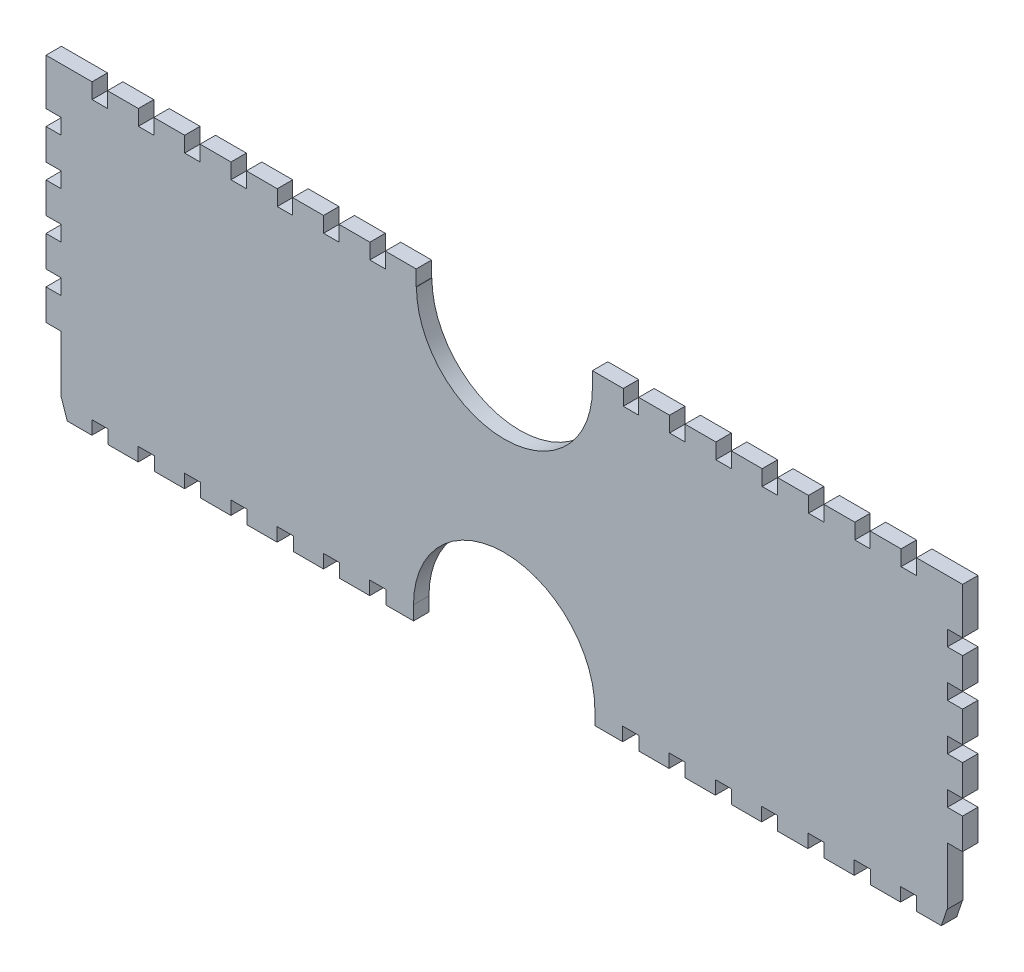
from build123d import *

# Parameters (mm, degrees)
ESQUISSE1_W                = 296.913296363
ESQUISSE1_H                = 99.202689883
BOSS_EXTRU_1_DEPTH         = 5
ENL_V_MAT_EXTRU_1_DEPTH    = 10
ESQUISSE3_W                = 5.229303798
ESQUISSE3_H                = 4.396229451
ENL_V_MAT_EXTRU_2_DEPTH    = 10
R_P_TITION_LIN_AIRE1_COUNT = 7
R_P_TITION_LIN_AIRE1_PITCH = 15
SYM_TRIE1_COPY_1_SKETCH_W  = 5.229303798
SYM_TRIE1_COPY_1_SKETCH_H  = 4.396229451
SYM_TRIE1_COPY_1_DEPTH     = 10
SYM_TRIE1_COPY_2_SKETCH_W  = 5.229303798
SYM_TRIE1_COPY_2_SKETCH_H  = 4.396229451
SYM_TRIE1_COPY_2_DEPTH     = 10
SYM_TRIE1_COPY_3_SKETCH_W  = 5.229303798
SYM_TRIE1_COPY_3_SKETCH_H  = 4.396229451
SYM_TRIE1_COPY_3_DEPTH     = 10
SYM_TRIE1_COPY_4_SKETCH_W  = 5.229303798
SYM_TRIE1_COPY_4_SKETCH_H  = 4.396229451
SYM_TRIE1_COPY_4_DEPTH     = 10
SYM_TRIE1_COPY_5_SKETCH_W  = 5.229303798
SYM_TRIE1_COPY_5_SKETCH_H  = 4.396229451
SYM_TRIE1_COPY_5_DEPTH     = 10
SYM_TRIE1_COPY_6_SKETCH_W  = 5.229303798
SYM_TRIE1_COPY_6_SKETCH_H  = 4.396229451
SYM_TRIE1_COPY_6_DEPTH     = 10
ESQUISSE4_W                = 58.738288448
ESQUISSE4_H                = 4.540442772
ENL_V_MAT_EXTRU_3_DEPTH    = 10
ENL_V_MAT_EXTRU_4_DEPTH    = 10
ESQUISSE6_W                = 5
ESQUISSE6_H                = 5
ENL_V_MAT_EXTRU_5_DEPTH    = 5
R_P_TITION_LIN_AIRE2_COUNT = 8
R_P_TITION_LIN_AIRE2_PITCH = 15
ESQUISSE7_W                = 57
ESQUISSE7_H                = 5
ENL_V_MAT_EXTRU_6_DEPTH    = 5
ENL_V_MAT_EXTRU_7_DEPTH    = 5
SYM_TRIE2_COPY_1_SKETCH_W  = 5
SYM_TRIE2_COPY_1_SKETCH_H  = 5
SYM_TRIE2_COPY_1_DEPTH     = 5
SYM_TRIE2_COPY_2_SKETCH_W  = 5
SYM_TRIE2_COPY_2_SKETCH_H  = 5
SYM_TRIE2_COPY_2_DEPTH     = 5
SYM_TRIE2_COPY_3_SKETCH_W  = 5
SYM_TRIE2_COPY_3_SKETCH_H  = 5
SYM_TRIE2_COPY_3_DEPTH     = 5
SYM_TRIE2_COPY_4_SKETCH_W  = 5
SYM_TRIE2_COPY_4_SKETCH_H  = 5
SYM_TRIE2_COPY_4_DEPTH     = 5
SYM_TRIE2_COPY_5_SKETCH_W  = 5
SYM_TRIE2_COPY_5_SKETCH_H  = 5
SYM_TRIE2_COPY_5_DEPTH     = 5
SYM_TRIE2_COPY_6_SKETCH_W  = 5
SYM_TRIE2_COPY_6_SKETCH_H  = 5
SYM_TRIE2_COPY_6_DEPTH     = 5
SYM_TRIE2_COPY_7_SKETCH_W  = 5
SYM_TRIE2_COPY_7_SKETCH_H  = 5
SYM_TRIE2_COPY_7_DEPTH     = 5
ESQUISSE9_W                = 4.913296363
ESQUISSE9_H                = 18.600386247
ENL_V_MAT_EXTRU_8_DEPTH    = 5
ESQUISSE10_W               = 5
ESQUISSE10_H               = 5
ENL_V_MAT_EXTRU_9_DEPTH    = 5
R_P_TITION_LIN_AIRE3_COUNT = 4
R_P_TITION_LIN_AIRE3_PITCH = 15
SYM_TRIE3_COPY_1_SKETCH_W  = 5
SYM_TRIE3_COPY_1_SKETCH_H  = 5
SYM_TRIE3_COPY_1_DEPTH     = 5
SYM_TRIE3_COPY_2_SKETCH_W  = 5
SYM_TRIE3_COPY_2_SKETCH_H  = 5
SYM_TRIE3_COPY_2_DEPTH     = 5
SYM_TRIE3_COPY_3_SKETCH_W  = 5
SYM_TRIE3_COPY_3_SKETCH_H  = 5
SYM_TRIE3_COPY_3_DEPTH     = 5


with BuildPart() as part:
    # Esquisse1 → Boss.-Extru.1 (new body)
    with BuildSketch(Plane.XY):
        with Locations((104.081072913, -34.511559996)):
            Rectangle(ESQUISSE1_W, ESQUISSE1_H)
    extrude(amount=BOSS_EXTRU_1_DEPTH)

    # Esquisse2 → Enlèv. mat.-Extru.1 (cut)
    with BuildSketch(Plane(origin=(0, 0, 0), x_dir=(-1, 0, 0), z_dir=(0, 0, -1))):
        Polygon((44.375575269, -78.510601301), (39.375575269, -78.510601301), (37.504666451, -84.112904937), (44.375575269, -84.112904937), align=None)
    enl_v_mat_extru_1 = extrude(amount=-ENL_V_MAT_EXTRU_1_DEPTH, mode=Mode.SUBTRACT)

    # Esquisse3 → Enlèv. mat.-Extru.2 (cut)
    with BuildSketch(Plane(origin=(0, 0, 0), x_dir=(-1, 0, 0), z_dir=(0, 0, -1))):
        with Locations((26.890031572, -81.914790212)):
            Rectangle(ESQUISSE3_W, ESQUISSE3_H)
    enl_v_mat_extru_2 = extrude(amount=-ENL_V_MAT_EXTRU_2_DEPTH, mode=Mode.SUBTRACT)

    # Répétition linéaire1: Enlèv. mat.-Extru.2 ×7
    with Locations(*[(i * R_P_TITION_LIN_AIRE1_PITCH, 0, 0) for i in range(1, R_P_TITION_LIN_AIRE1_COUNT)]):
        add(enl_v_mat_extru_2, mode=Mode.SUBTRACT)

    # Symétrie1: Enlèv. mat.-Extru.1, Enlèv. mat.-Extru.2 across plane
    add(enl_v_mat_extru_1.mirror(Plane.ZY.offset(-104.081072913)), mode=Mode.SUBTRACT)
    add(enl_v_mat_extru_2.mirror(Plane.ZY.offset(-104.081072913)), mode=Mode.SUBTRACT)

    # Symétrie1 copy 1 sketch → Symétrie1 copy 1 (cut)
    with BuildSketch(Plane(origin=(193.162145825, 0, 0), x_dir=(1, 0, 0), z_dir=(0, 0, -1))):
        with Locations((26.890031572, 81.914790212)):
            Rectangle(SYM_TRIE1_COPY_1_SKETCH_W, SYM_TRIE1_COPY_1_SKETCH_H)
    extrude(amount=-SYM_TRIE1_COPY_1_DEPTH, mode=Mode.SUBTRACT)

    # Symétrie1 copy 2 sketch → Symétrie1 copy 2 (cut)
    with BuildSketch(Plane(origin=(178.162145825, 0, 0), x_dir=(1, 0, 0), z_dir=(0, 0, -1))):
        with Locations((26.890031572, 81.914790212)):
            Rectangle(SYM_TRIE1_COPY_2_SKETCH_W, SYM_TRIE1_COPY_2_SKETCH_H)
    extrude(amount=-SYM_TRIE1_COPY_2_DEPTH, mode=Mode.SUBTRACT)

    # Symétrie1 copy 3 sketch → Symétrie1 copy 3 (cut)
    with BuildSketch(Plane(origin=(163.162145825, 0, 0), x_dir=(1, 0, 0), z_dir=(0, 0, -1))):
        with Locations((26.890031572, 81.914790212)):
            Rectangle(SYM_TRIE1_COPY_3_SKETCH_W, SYM_TRIE1_COPY_3_SKETCH_H)
    extrude(amount=-SYM_TRIE1_COPY_3_DEPTH, mode=Mode.SUBTRACT)

    # Symétrie1 copy 4 sketch → Symétrie1 copy 4 (cut)
    with BuildSketch(Plane(origin=(148.162145825, 0, 0), x_dir=(1, 0, 0), z_dir=(0, 0, -1))):
        with Locations((26.890031572, 81.914790212)):
            Rectangle(SYM_TRIE1_COPY_4_SKETCH_W, SYM_TRIE1_COPY_4_SKETCH_H)
    extrude(amount=-SYM_TRIE1_COPY_4_DEPTH, mode=Mode.SUBTRACT)

    # Symétrie1 copy 5 sketch → Symétrie1 copy 5 (cut)
    with BuildSketch(Plane(origin=(133.162145825, 0, 0), x_dir=(1, 0, 0), z_dir=(0, 0, -1))):
        with Locations((26.890031572, 81.914790212)):
            Rectangle(SYM_TRIE1_COPY_5_SKETCH_W, SYM_TRIE1_COPY_5_SKETCH_H)
    extrude(amount=-SYM_TRIE1_COPY_5_DEPTH, mode=Mode.SUBTRACT)

    # Symétrie1 copy 6 sketch → Symétrie1 copy 6 (cut)
    with BuildSketch(Plane(origin=(118.162145825, 0, 0), x_dir=(1, 0, 0), z_dir=(0, 0, -1))):
        with Locations((26.890031572, 81.914790212)):
            Rectangle(SYM_TRIE1_COPY_6_SKETCH_W, SYM_TRIE1_COPY_6_SKETCH_H)
    extrude(amount=-SYM_TRIE1_COPY_6_DEPTH, mode=Mode.SUBTRACT)

    # Esquisse4 → Enlèv. mat.-Extru.3 (cut)
    with BuildSketch(Plane(origin=(0, 0, 0), x_dir=(-1, 0, 0), z_dir=(0, 0, -1))):
        with Locations((-104.051236875, -81.842683551)):
            Rectangle(ESQUISSE4_W, ESQUISSE4_H)
    extrude(amount=-ENL_V_MAT_EXTRU_3_DEPTH, mode=Mode.SUBTRACT)

    # Esquisse5 → Enlèv. mat.-Extru.4 (cut)
    with BuildSketch(Plane(origin=(0, 0, 0), x_dir=(-1, 0, 0), z_dir=(0, 0, -1))):
        with BuildLine():
            Line((-74.682092651, -79.572462165), (-133.420381099, -79.572462165))
            ThreePointArc((-133.420381099, -79.572462165), (-104.051236875, -50.20331794), (-74.682092651, -79.572462165))
        make_face()
    extrude(amount=-ENL_V_MAT_EXTRU_4_DEPTH, mode=Mode.SUBTRACT)

    # Esquisse6 → Enlèv. mat.-Extru.5 (cut)
    with BuildSketch(Plane.XY.offset(5)):
        with Locations((235.124424731, 12.589784946)):
            Rectangle(ESQUISSE6_W, ESQUISSE6_H)
    enl_v_mat_extru_5 = extrude(amount=-ENL_V_MAT_EXTRU_5_DEPTH, mode=Mode.SUBTRACT)

    # Répétition linéaire2: Enlèv. mat.-Extru.5 ×8
    with Locations(*[(-i * R_P_TITION_LIN_AIRE2_PITCH, 0, 0) for i in range(1, R_P_TITION_LIN_AIRE2_COUNT)]):
        add(enl_v_mat_extru_5, mode=Mode.SUBTRACT)

    # Esquisse7 → Enlèv. mat.-Extru.6 (cut)
    with BuildSketch(Plane.XY.offset(5)):
        with Locations((104.124424731, 12.589784946)):
            Rectangle(ESQUISSE7_W, ESQUISSE7_H)
    extrude(amount=-ENL_V_MAT_EXTRU_6_DEPTH, mode=Mode.SUBTRACT)

    # Esquisse8 → Enlèv. mat.-Extru.7 (cut)
    with BuildSketch(Plane.XY.offset(5)):
        with BuildLine():
            ThreePointArc((132.624424731, 10.089784946), (104.124424731, -18.410215054), (75.624424731, 10.089784946))
            Line((75.624424731, 10.089784946), (132.624424731, 10.089784946))
        make_face()
    extrude(amount=-ENL_V_MAT_EXTRU_7_DEPTH, mode=Mode.SUBTRACT)

    # Symétrie2: Enlèv. mat.-Extru.5 across plane
    add(enl_v_mat_extru_5.mirror(Plane(origin=(104.081072913, 0, 0), x_dir=(0, 0, 1), z_dir=(1, 0, 0))), mode=Mode.SUBTRACT)

    # Symétrie2 copy 1 sketch → Symétrie2 copy 1 (cut)
    with BuildSketch(Plane(origin=(223.162145825, 0, 5), x_dir=(-1, 0, 0), z_dir=(0, 0, 1))):
        with Locations((235.124424731, -12.589784946)):
            Rectangle(SYM_TRIE2_COPY_1_SKETCH_W, SYM_TRIE2_COPY_1_SKETCH_H)
    extrude(amount=-SYM_TRIE2_COPY_1_DEPTH, mode=Mode.SUBTRACT)

    # Symétrie2 copy 2 sketch → Symétrie2 copy 2 (cut)
    with BuildSketch(Plane(origin=(238.162145825, 0, 5), x_dir=(-1, 0, 0), z_dir=(0, 0, 1))):
        with Locations((235.124424731, -12.589784946)):
            Rectangle(SYM_TRIE2_COPY_2_SKETCH_W, SYM_TRIE2_COPY_2_SKETCH_H)
    extrude(amount=-SYM_TRIE2_COPY_2_DEPTH, mode=Mode.SUBTRACT)

    # Symétrie2 copy 3 sketch → Symétrie2 copy 3 (cut)
    with BuildSketch(Plane(origin=(253.162145825, 0, 5), x_dir=(-1, 0, 0), z_dir=(0, 0, 1))):
        with Locations((235.124424731, -12.589784946)):
            Rectangle(SYM_TRIE2_COPY_3_SKETCH_W, SYM_TRIE2_COPY_3_SKETCH_H)
    extrude(amount=-SYM_TRIE2_COPY_3_DEPTH, mode=Mode.SUBTRACT)

    # Symétrie2 copy 4 sketch → Symétrie2 copy 4 (cut)
    with BuildSketch(Plane(origin=(268.162145825, 0, 5), x_dir=(-1, 0, 0), z_dir=(0, 0, 1))):
        with Locations((235.124424731, -12.589784946)):
            Rectangle(SYM_TRIE2_COPY_4_SKETCH_W, SYM_TRIE2_COPY_4_SKETCH_H)
    extrude(amount=-SYM_TRIE2_COPY_4_DEPTH, mode=Mode.SUBTRACT)

    # Symétrie2 copy 5 sketch → Symétrie2 copy 5 (cut)
    with BuildSketch(Plane(origin=(283.162145825, 0, 5), x_dir=(-1, 0, 0), z_dir=(0, 0, 1))):
        with Locations((235.124424731, -12.589784946)):
            Rectangle(SYM_TRIE2_COPY_5_SKETCH_W, SYM_TRIE2_COPY_5_SKETCH_H)
    extrude(amount=-SYM_TRIE2_COPY_5_DEPTH, mode=Mode.SUBTRACT)

    # Symétrie2 copy 6 sketch → Symétrie2 copy 6 (cut)
    with BuildSketch(Plane(origin=(298.162145825, 0, 5), x_dir=(-1, 0, 0), z_dir=(0, 0, 1))):
        with Locations((235.124424731, -12.589784946)):
            Rectangle(SYM_TRIE2_COPY_6_SKETCH_W, SYM_TRIE2_COPY_6_SKETCH_H)
    extrude(amount=-SYM_TRIE2_COPY_6_DEPTH, mode=Mode.SUBTRACT)

    # Symétrie2 copy 7 sketch → Symétrie2 copy 7 (cut)
    with BuildSketch(Plane(origin=(313.162145825, 0, 5), x_dir=(-1, 0, 0), z_dir=(0, 0, 1))):
        with Locations((235.124424731, -12.589784946)):
            Rectangle(SYM_TRIE2_COPY_7_SKETCH_W, SYM_TRIE2_COPY_7_SKETCH_H)
    extrude(amount=-SYM_TRIE2_COPY_7_DEPTH, mode=Mode.SUBTRACT)

    # Esquisse9 → Enlèv. mat.-Extru.8 (cut)
    with BuildSketch(Plane.XY.offset(5)):
        with Locations((250.081072913, -69.210408177)):
            Rectangle(ESQUISSE9_W, ESQUISSE9_H)
    enl_v_mat_extru_8 = extrude(amount=-ENL_V_MAT_EXTRU_8_DEPTH, mode=Mode.SUBTRACT)

    # Esquisse10 → Enlèv. mat.-Extru.9 (cut)
    with BuildSketch(Plane.XY.offset(5)):
        with Locations((250.124424731, -47.410215054)):
            Rectangle(ESQUISSE10_W, ESQUISSE10_H)
    enl_v_mat_extru_9 = extrude(amount=-ENL_V_MAT_EXTRU_9_DEPTH, mode=Mode.SUBTRACT)

    # Répétition linéaire3: Enlèv. mat.-Extru.9 ×4
    with Locations(*[(0, i * R_P_TITION_LIN_AIRE3_PITCH, 0) for i in range(1, R_P_TITION_LIN_AIRE3_COUNT)]):
        add(enl_v_mat_extru_9, mode=Mode.SUBTRACT)

    # Symétrie3: Enlèv. mat.-Extru.8, Enlèv. mat.-Extru.9 across plane
    add(enl_v_mat_extru_8.mirror(Plane(origin=(104.081072913, 0, 0), x_dir=(0, 0, 1), z_dir=(1, 0, 0))), mode=Mode.SUBTRACT)
    add(enl_v_mat_extru_9.mirror(Plane(origin=(104.081072913, 0, 0), x_dir=(0, 0, 1), z_dir=(1, 0, 0))), mode=Mode.SUBTRACT)

    # Symétrie3 copy 1 sketch → Symétrie3 copy 1 (cut)
    with BuildSketch(Plane(origin=(208.162145825, 15, 5), x_dir=(-1, 0, 0), z_dir=(0, 0, 1))):
        with Locations((250.124424731, 47.410215054)):
            Rectangle(SYM_TRIE3_COPY_1_SKETCH_W, SYM_TRIE3_COPY_1_SKETCH_H)
    extrude(amount=-SYM_TRIE3_COPY_1_DEPTH, mode=Mode.SUBTRACT)

    # Symétrie3 copy 2 sketch → Symétrie3 copy 2 (cut)
    with BuildSketch(Plane(origin=(208.162145825, 30, 5), x_dir=(-1, 0, 0), z_dir=(0, 0, 1))):
        with Locations((250.124424731, 47.410215054)):
            Rectangle(SYM_TRIE3_COPY_2_SKETCH_W, SYM_TRIE3_COPY_2_SKETCH_H)
    extrude(amount=-SYM_TRIE3_COPY_2_DEPTH, mode=Mode.SUBTRACT)

    # Symétrie3 copy 3 sketch → Symétrie3 copy 3 (cut)
    with BuildSketch(Plane(origin=(208.162145825, 45, 5), x_dir=(-1, 0, 0), z_dir=(0, 0, 1))):
        with Locations((250.124424731, 47.410215054)):
            Rectangle(SYM_TRIE3_COPY_3_SKETCH_W, SYM_TRIE3_COPY_3_SKETCH_H)
    extrude(amount=-SYM_TRIE3_COPY_3_DEPTH, mode=Mode.SUBTRACT)


solid = part.part
